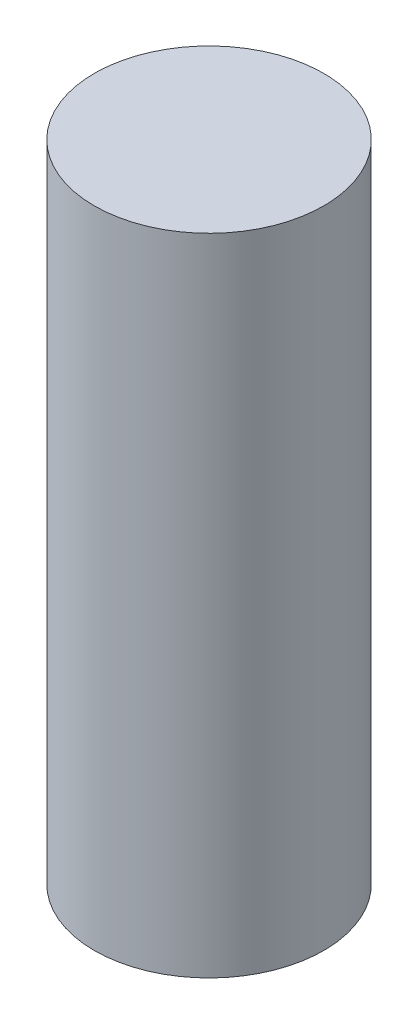
from build123d import *

# Parameters (mm, degrees)
SKETCH1_R           = 17.399
BOSS_EXTRUDE1_DEPTH = 97.79


with BuildPart() as part:
    # Sketch1 → Boss-Extrude1 (new body)
    with BuildSketch(Plane(origin=(0, 0, 0), x_dir=(1, 0, 0), z_dir=(0, 1, 0))):
        with Locations(Location((0, 0, 0), (0, 0, 270))):
            Circle(SKETCH1_R)
    extrude(amount=BOSS_EXTRUDE1_DEPTH)


solid = part.part
